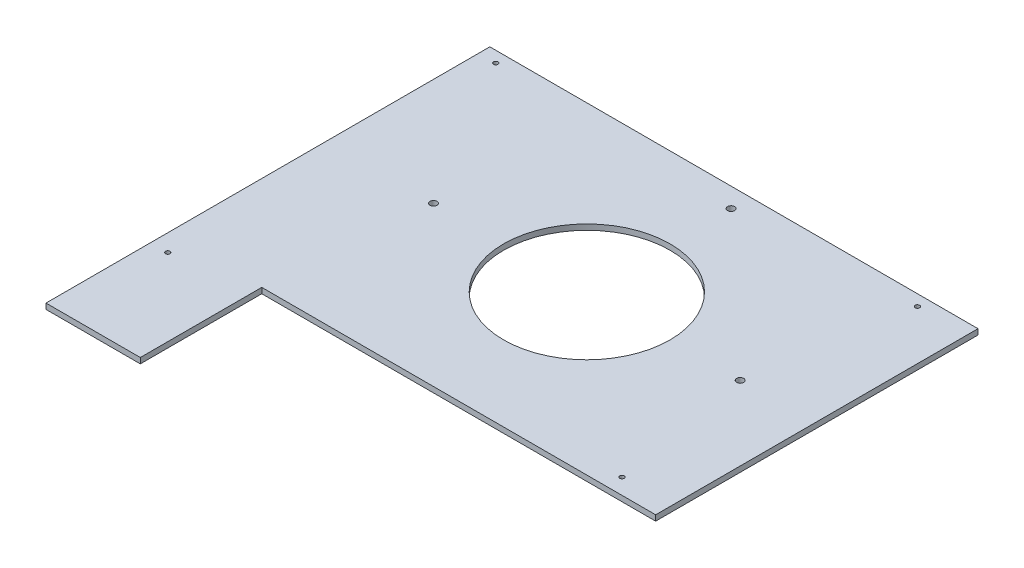
from build123d import *

# Parameters (mm, degrees)
CROQUIS2_R              = 75
CROQUIS2_R_2            = 2
CROQUIS2_R_3            = 3.175
SALIENTE_EXTRUIR2_DEPTH = 5


with BuildPart() as part:
    # Croquis2 → Saliente-Extruir2 (new body)
    with BuildSketch(Plane(origin=(0, 0, 0), x_dir=(1, 0, 0), z_dir=(0, 1, 0))):
        Polygon((-164.024069274, 177.568942162), (-164.024069274, -142.431057838), (-164.024069274, -189.256710106), (-164.024069274, -222.426710106), (-79.024069274, -222.426710106), (-79.024069274, -189.256710106), (-79.024069274, -142.431057838), (-79.024069274, -112.958468136), (275.975930726, -112.958468136), (275.975930726, 177.568942162), align=None)
        with Locations(Location((70.975930726, 30.02579809, 0), (0, 0, 270))):
            Circle(CROQUIS2_R, mode=Mode.SUBTRACT)
        with Locations(Location((-148.613055051, 167.568942162, 0), (0, 0, 270))):
            Circle(CROQUIS2_R_2, mode=Mode.SUBTRACT)
        with Locations(Location((-148.613055051, -128.145081947, 0), (0, 0, 270))):
            Circle(CROQUIS2_R_2, mode=Mode.SUBTRACT)
        with Locations(Location((231.386944949, -98.672492245, 0), (0, 0, 270))):
            Circle(CROQUIS2_R_2, mode=Mode.SUBTRACT)
        with Locations(Location((231.386944949, 167.568942162, 0), (0, 0, 270))):
            Circle(CROQUIS2_R_2, mode=Mode.SUBTRACT)
        with Locations(Location((209.175930726, 30.02579809, 0), (0, 0, 270))):
            Circle(CROQUIS2_R_3, mode=Mode.SUBTRACT)
        with Locations(Location((-67.224069274, 30.02579809, 0), (0, 0, 270))):
            Circle(CROQUIS2_R_3, mode=Mode.SUBTRACT)
        with Locations(Location((70.975930726, 160.02579809, 0), (0, 0, 270))):
            Circle(CROQUIS2_R_3, mode=Mode.SUBTRACT)
    extrude(amount=SALIENTE_EXTRUIR2_DEPTH)


solid = part.part
